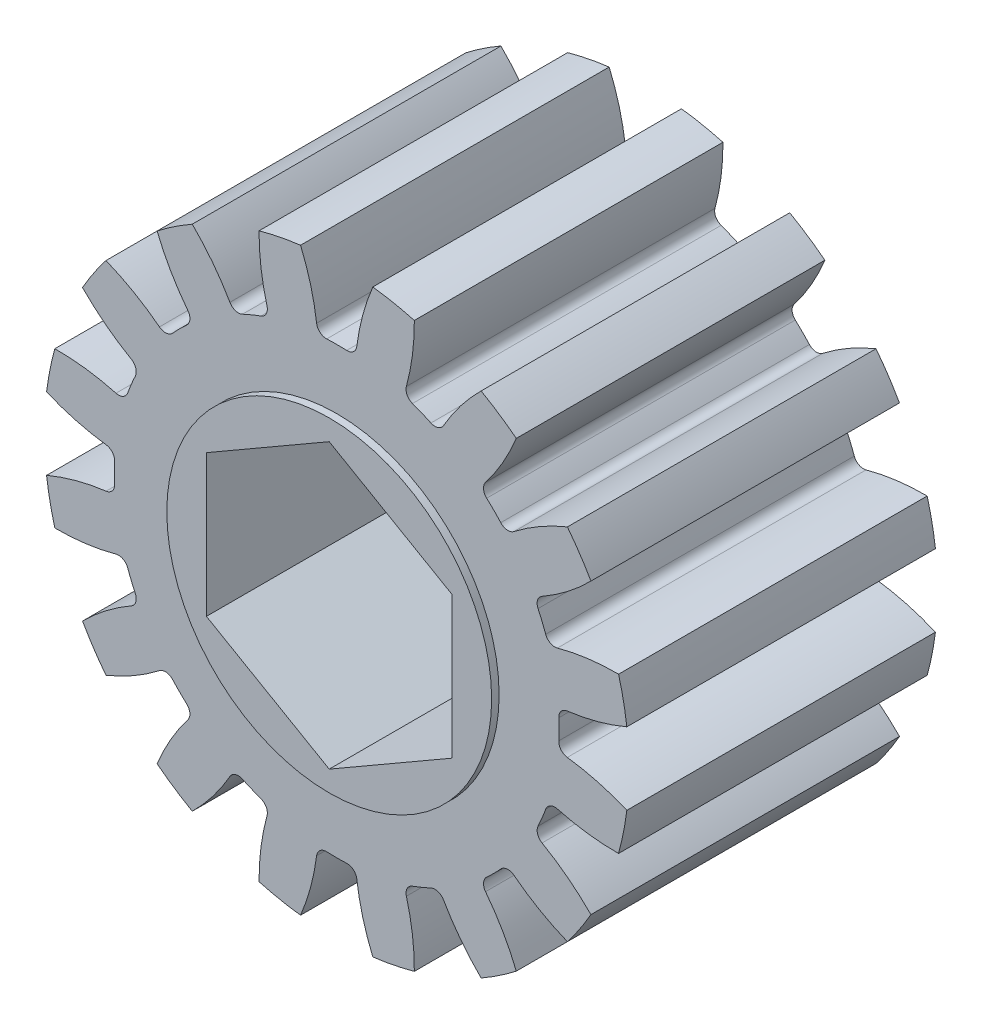
from build123d import *

# Parameters (mm, degrees)
CROQUIS1_R                 = 11.43
SALIENTE_EXTRUIR1_DEPTH    = 6.0325
CORTAR_EXTRUIR1_DEPTH      = 18.253430275
REDONDEO1_R                = 0.381028065
MATRIZC1_COUNT             = 16
REDONDEO1_OF_MATRIZC1_R    = 0.381028065
CROQUIS3_R                 = 6.35
SALIENTE_EXTRUIR2_DEPTH    = 6.3246
CORTAR_EXTRUIR2_DEPTH      = 18.242299714
CORTAR_EXTRUIR2_DEPTH_BACK = 18.242299714


with BuildPart() as part:
    # Croquis1 → Saliente-Extruir1 (new, symmetric)
    with BuildSketch(Plane.XY):
        with Locations(Location((0, 0, 0), (0, 0, 180))):
            Circle(CROQUIS1_R)
    extrude(amount=SALIENTE_EXTRUIR1_DEPTH, both=True)

    # Croquis2 → Cortar-Extruir1 (cut, symmetric)
    with BuildSketch(Plane.XY):
        with BuildLine():
            ThreePointArc((0.747134277, 8.658434763), (0, 8.69061), (-0.747134277, 8.658434763))
            ThreePointArc((-0.747134277, 8.658434763), (-0.974448264, 10.026589531), (-1.413058789, 11.342317438))
            ThreePointArc((-1.413058789, 11.342317438), (0, 11.43), (1.413058789, 11.342317438))
            ThreePointArc((1.413058789, 11.342317438), (0.974448264, 10.026589531), (0.747134277, 8.658434763))
        make_face()
    cortar_extruir1 = extrude(amount=CORTAR_EXTRUIR1_DEPTH, both=True, mode=Mode.SUBTRACT)

    # Redondeo1
    redondeo1_edges = [part.edges().sort_by_distance(p)[0] for p in [
        (0.747134277, 8.658434763, 0),
        (-0.747134277, 8.658434763, 0),
    ]]
    fillet(redondeo1_edges, radius=REDONDEO1_R)

    # MatrizC1: Cortar-Extruir1 ×16 about axis
    matrizc1_axis = Axis((0, 0, 0), (0, 0, 1))
    for i in range(1, MATRIZC1_COUNT):
        add(cortar_extruir1.rotate(matrizc1_axis, i * 360 / MATRIZC1_COUNT), mode=Mode.SUBTRACT)

    # Redondeo1 of MatrizC1
    redondeo1_of_matrizc1_edges = [part.edges().sort_by_distance(p)[0] for p in [
        (-2.623177467, 8.285266571, 0),
        (-4.003701601, 7.713434751, 0),
        (-5.594134221, 6.650741649, 0),
        (-6.650741649, 5.594134221, 0),
        (-7.713434751, 4.003701601, 0),
        (-8.285266571, 2.623177467, 0),
        (-8.658434763, 0.747134277, 0),
        (-8.658434763, -0.747134277, 0),
        (-8.285266571, -2.623177467, 0),
        (-7.713434751, -4.003701601, 0),
        (-6.650741649, -5.594134221, 0),
        (-5.594134221, -6.650741649, 0),
        (-4.003701601, -7.713434751, 0),
        (-2.623177467, -8.285266571, 0),
        (-0.747134277, -8.658434763, 0),
        (0.747134277, -8.658434763, 0),
        (2.623177467, -8.285266571, 0),
        (4.003701601, -7.713434751, 0),
        (5.594134221, -6.650741649, 0),
        (6.650741649, -5.594134221, 0),
        (7.713434751, -4.003701601, 0),
        (8.285266571, -2.623177467, 0),
        (8.658434763, -0.747134277, 0),
        (8.658434763, 0.747134277, 0),
        (8.285266571, 2.623177467, 0),
        (7.713434751, 4.003701601, 0),
        (6.650741649, 5.594134221, 0),
        (5.594134221, 6.650741649, 0),
        (4.003701601, 7.713434751, 0),
        (2.623177467, 8.285266571, 0),
    ]]
    fillet(redondeo1_of_matrizc1_edges, radius=REDONDEO1_OF_MATRIZC1_R)

    # Croquis3 → Saliente-Extruir2 (add, symmetric)
    with BuildSketch(Plane.XY):
        Circle(CROQUIS3_R)
    extrude(amount=SALIENTE_EXTRUIR2_DEPTH, both=True)

    # Croquis4 → Cortar-Extruir2 (cut, two sides: drawn at the far end of the back side and taken through both)
    with BuildSketch(Plane.XY.offset(-CORTAR_EXTRUIR2_DEPTH_BACK)):
        Polygon((0, 5.543255405), (-4.8006, 2.771627702), (-4.8006, -2.771627702), (0, -5.543255405), (4.8006, -2.771627702), (4.8006, 2.771627702), align=None)
    extrude(amount=CORTAR_EXTRUIR2_DEPTH + CORTAR_EXTRUIR2_DEPTH_BACK, mode=Mode.SUBTRACT)


solid = part.part
